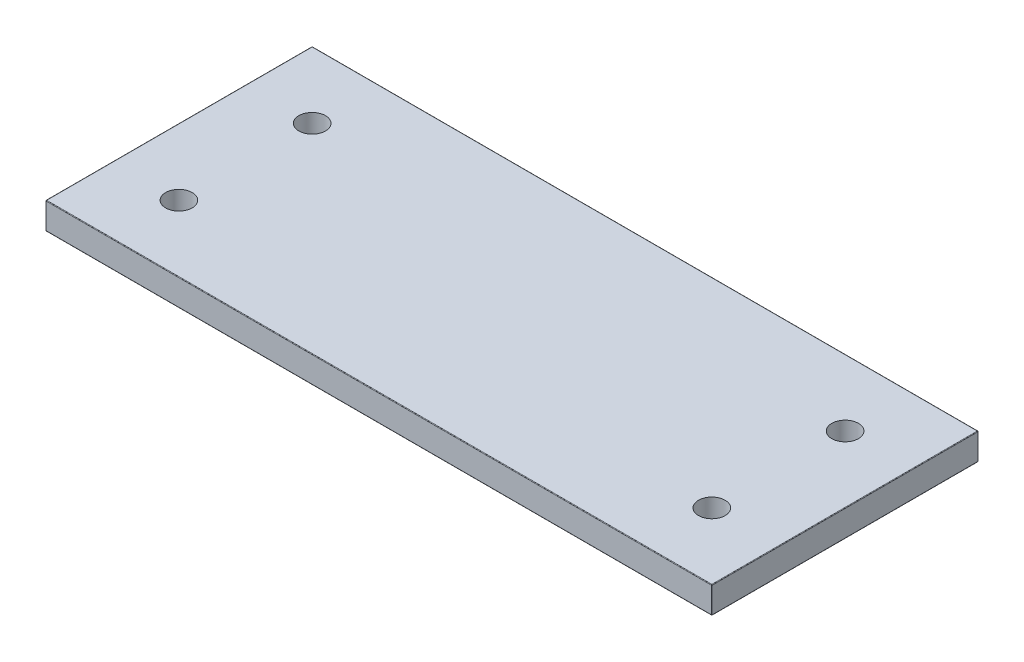
from build123d import *

# Parameters (mm, degrees)
SKETCH1_W           = 250
SKETCH1_H           = 100
SKETCH1_R           = 5
BOSS_EXTRUDE1_DEPTH = 10
FILLET1_R           = 0.2


with BuildPart() as part:
    # Sketch1 → Boss-Extrude1 (new body)
    with BuildSketch(Plane(origin=(0, 0, 0), x_dir=(1, 0, 0), z_dir=(0, 1, 0))):
        Rectangle(SKETCH1_W, SKETCH1_H)
        with Locations(Location((100, 25, 0), (0, 0, 270))):
            Circle(SKETCH1_R, mode=Mode.SUBTRACT)
        with Locations(Location((100, -25, 0), (0, 0, 90))):
            Circle(SKETCH1_R, mode=Mode.SUBTRACT)
        with Locations(Location((-100, -25, 0), (0, 0, 270))):
            Circle(SKETCH1_R, mode=Mode.SUBTRACT)
        with Locations(Location((-100, 25, 0), (0, 0, 90))):
            Circle(SKETCH1_R, mode=Mode.SUBTRACT)
    extrude(amount=BOSS_EXTRUDE1_DEPTH)

    # Fillet1
    fillet1_edges = [part.edges().sort_by_distance(p)[0] for p in [
        (-125, 10, 0),
        (0, 10, 50),
        (125, 10, 0),
        (0, 0, 50),
        (-125, 0, 0),
        (0, 0, -50),
        (125, 0, 0),
        (0, 10, -50),
        (125, 5, 50),
        (-125, 5, 50),
        (-125, 5, -50),
        (125, 5, -50),
    ]]
    fillet(fillet1_edges, radius=FILLET1_R)


solid = part.part
